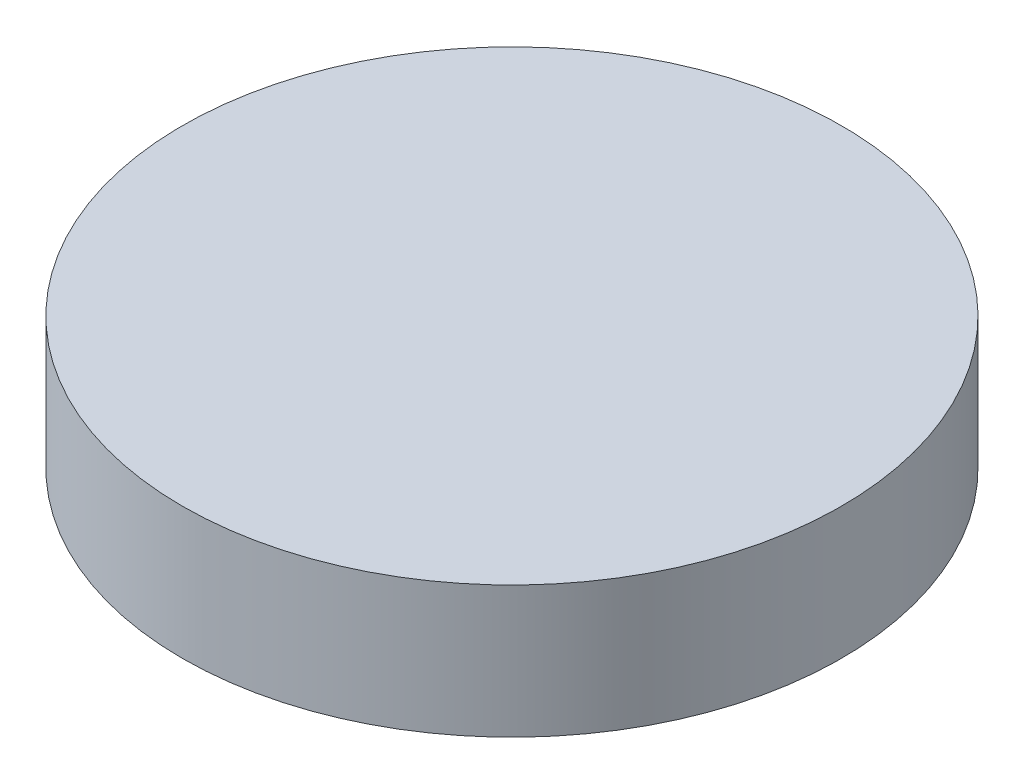
from build123d import *

# Parameters (mm, degrees)
SKETCH2_R           = 10
BOSS_EXTRUDE1_DEPTH = 4


with BuildPart() as part:
    # Sketch2 → Boss-Extrude1 (new body)
    with BuildSketch(Plane(origin=(0, 0, 0), x_dir=(1, 0, 0), z_dir=(0, 1, 0))):
        with Locations(Location((0, 0, 0), (0, 0, 270))):
            Circle(SKETCH2_R)
    extrude(amount=BOSS_EXTRUDE1_DEPTH)


solid = part.part
